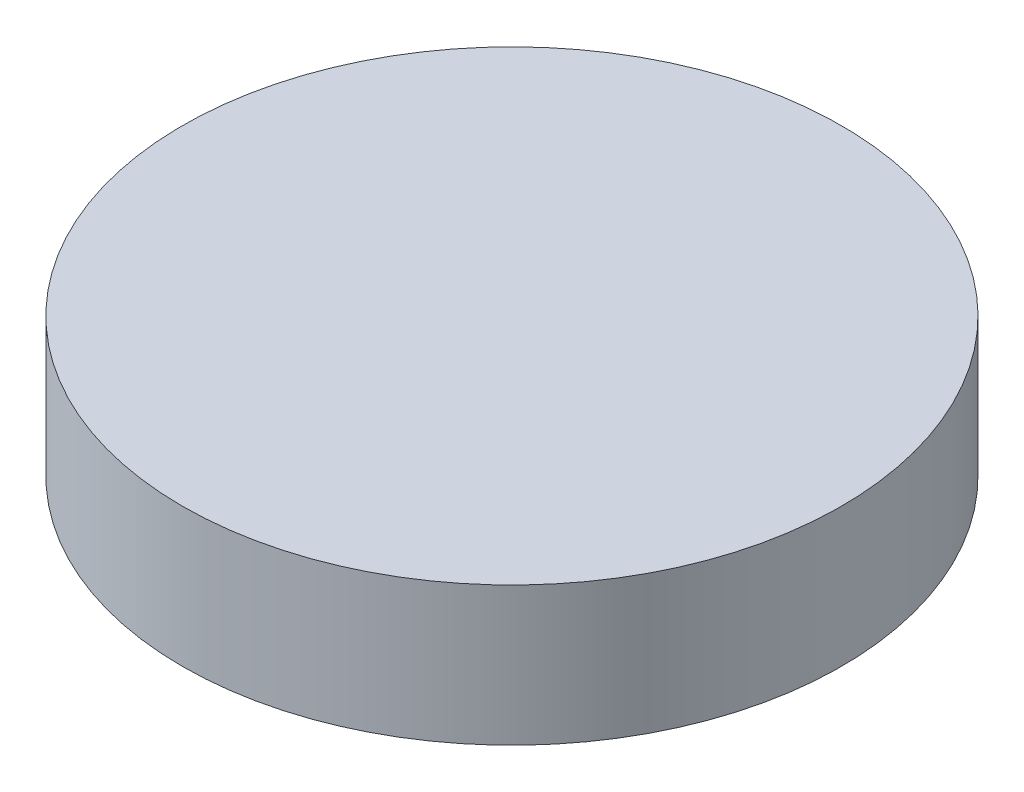
from build123d import *

# Parameters (mm, degrees)
ESBO_O1_R                = 9.5
RESSALTO_EXTRUS_O1_DEPTH = 4


with BuildPart() as part:
    # Esboço1 → Ressalto-extrusão1 (new body)
    with BuildSketch(Plane(origin=(0, 0, 0), x_dir=(1, 0, 0), z_dir=(0, 1, 0))):
        with Locations(Location((0, 0, 0), (0, 0, 270))):
            Circle(ESBO_O1_R)
    extrude(amount=RESSALTO_EXTRUS_O1_DEPTH)


solid = part.part
